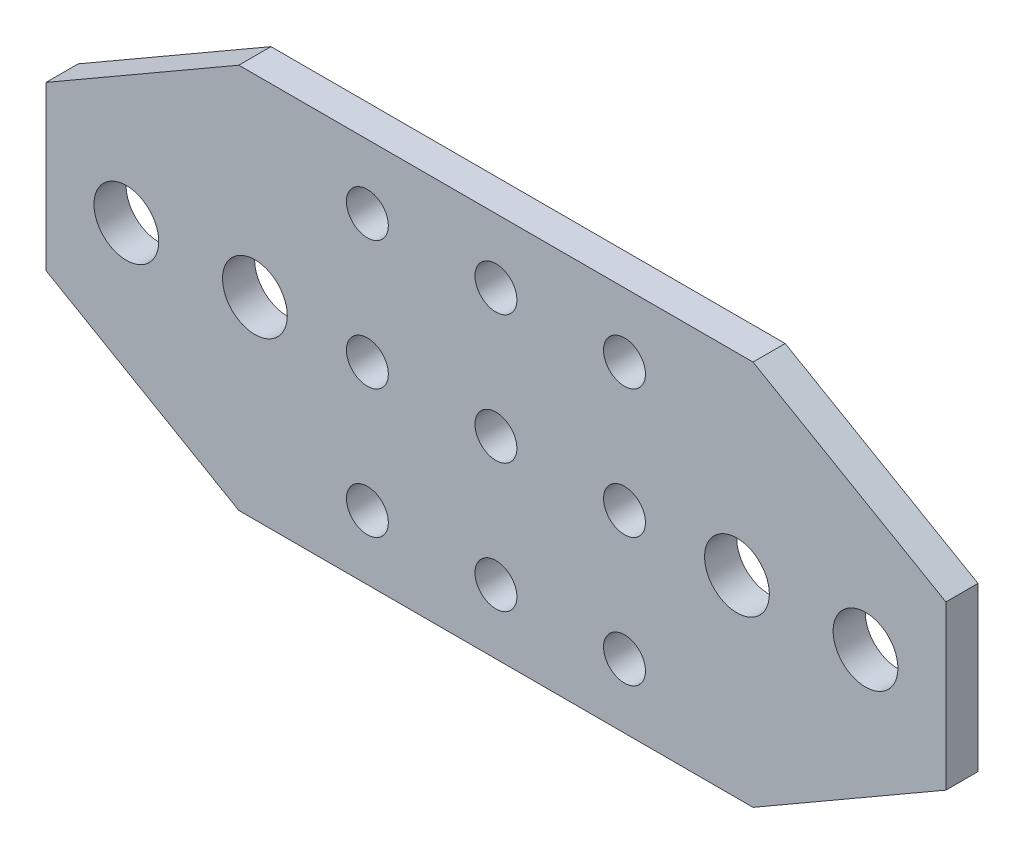
from build123d import *

# Parameters (mm, degrees)
SKETCH1_R           = 3.2004
SKETCH1_R_2         = 2.0701
BOSS_EXTRUDE1_DEPTH = 3.175


with BuildPart() as part:
    # Sketch1 → Boss-Extrude1 (new body)
    with BuildSketch(Plane(origin=(0, 0, 0), x_dir=(-1, 0, 0), z_dir=(0, 0, -1))):
        Polygon((44.45, -8.051477372), (44.45, 8.051477372), (25.4, 19.05), (-25.4, 19.05), (-44.45, 8.051477372), (-44.45, -8.051477372), (-25.4, -19.05), (25.4, -19.05), align=None)
        with Locations(Location((23.8125, 0, 0), (0, 0, 180))):
            Circle(SKETCH1_R, mode=Mode.SUBTRACT)
        with Locations(Location((0, -12.7, 0), (0, 0, 180))):
            Circle(SKETCH1_R_2, mode=Mode.SUBTRACT)
        with Locations(Location((0, 12.7, 0), (0, 0, 180))):
            Circle(SKETCH1_R_2, mode=Mode.SUBTRACT)
        with Locations(Location((0, 0, 0), (0, 0, 180))):
            Circle(SKETCH1_R_2, mode=Mode.SUBTRACT)
        with Locations(Location((36.5125, 0, 0), (0, 0, 180))):
            Circle(SKETCH1_R, mode=Mode.SUBTRACT)
        with Locations(Location((-12.7, -12.7, 0), (0, 0, 180))):
            Circle(SKETCH1_R_2, mode=Mode.SUBTRACT)
        with Locations(Location((12.7, 12.7, 0), (0, 0, 180))):
            Circle(SKETCH1_R_2, mode=Mode.SUBTRACT)
        with Locations(Location((12.7, -12.7, 0), (0, 0, 180))):
            Circle(SKETCH1_R_2, mode=Mode.SUBTRACT)
        with Locations(Location((-12.7, 12.7, 0), (0, 0, 180))):
            Circle(SKETCH1_R_2, mode=Mode.SUBTRACT)
        with Locations(Location((-36.5125, 0, 0), (0, 0, 180))):
            Circle(SKETCH1_R, mode=Mode.SUBTRACT)
        with Locations(Location((12.7, 0, 0), (0, 0, 180))):
            Circle(SKETCH1_R_2, mode=Mode.SUBTRACT)
        with Locations(Location((-12.7, 0, 0), (0, 0, 180))):
            Circle(SKETCH1_R_2, mode=Mode.SUBTRACT)
        with Locations(Location((-23.8125, 0, 0), (0, 0, 180))):
            Circle(SKETCH1_R, mode=Mode.SUBTRACT)
    extrude(amount=-BOSS_EXTRUDE1_DEPTH)


solid = part.part
